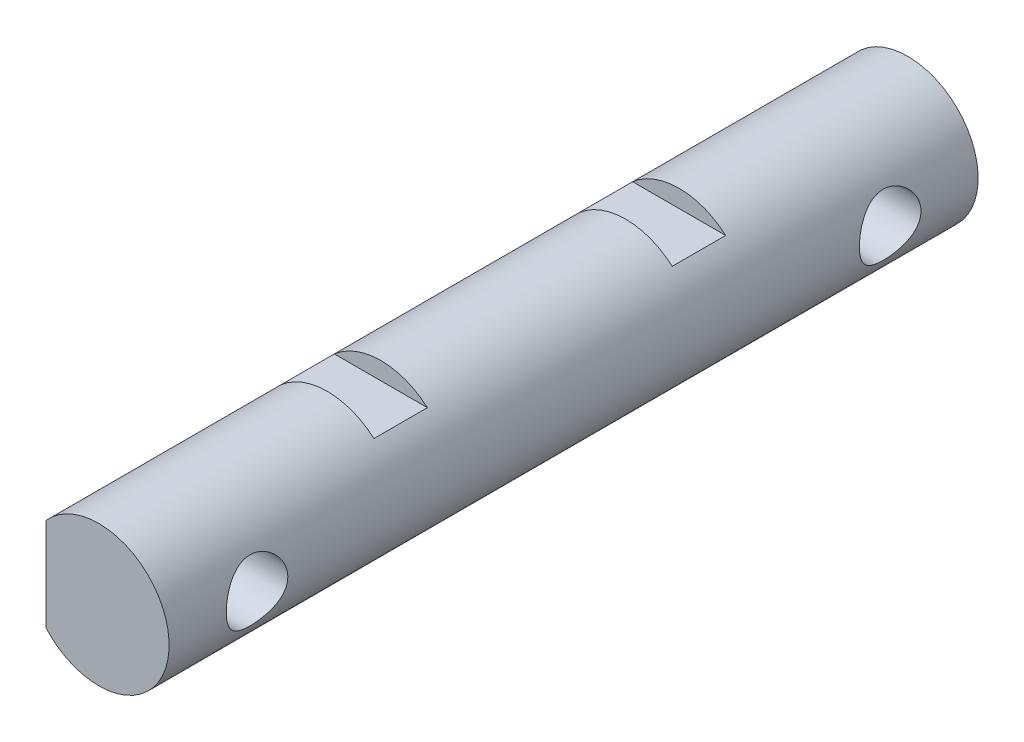
from build123d import *

# Parameters (mm, degrees)
SKETCH_1_R           = 20
EXTRUDE_1_DEPTH      = 115
CUT_EXTRUDE_START    = -65
SKETCH_2_OUTSIDE_W   = 89.37
SKETCH_2_OUTSIDE_H   = 89.37
SKETCH_2_OUTSIDE_W_2 = 80.530626202
SKETCH_2_OUTSIDE_H_2 = 30
CUT_EXTRUDE_1_DEPTH  = 15.2
CUT_EXTRUDE_2_DEPTH  = 50


with BuildPart() as part:
    # 草图1 → 凸台-拉伸1 (new, symmetric)
    with BuildSketch(Plane.XY):
        Circle(SKETCH_1_R)
    extrude(amount=EXTRUDE_1_DEPTH, both=True)

    # 草图2 outside → 切除-拉伸1 (cut)
    with BuildSketch(Plane.XY.offset(115).offset(CUT_EXTRUDE_START)):
        Rectangle(SKETCH_2_OUTSIDE_W, SKETCH_2_OUTSIDE_H)
        Rectangle(SKETCH_2_OUTSIDE_W_2, SKETCH_2_OUTSIDE_H_2, mode=Mode.SUBTRACT)
    cut_extrude_1 = extrude(amount=-CUT_EXTRUDE_1_DEPTH, mode=Mode.SUBTRACT)

    # 草图3 → 切除-拉伸2 (cut)
    with BuildSketch(Plane.XY.offset(115)):
        Polygon((-15, -119.751298217), (-15, -13.228756555), (-15, 13.228756555), (-15, 119.751298217), (-228.045083324, 119.751298217), (-228.045083324, -119.751298217), align=None)
    cut_extrude_2 = extrude(amount=-CUT_EXTRUDE_2_DEPTH, mode=Mode.SUBTRACT)

    # 草图4 → M20 螺纹孔1 (revolve, cut)
    with BuildSketch(Plane(origin=(-15, 0, 90), x_dir=(0, 0, 1), z_dir=(0, 1, 0))):
        Polygon((0, 0), (0, 52.757530416), (8.75, 47.5), (8.75, 0), align=None)
    hole_wizard_m20_1 = revolve(axis=Axis((-21.35, 0, 90), (1, 0, 0)), mode=Mode.SUBTRACT)

    # 镜向1: 切除-拉伸1, 切除-拉伸2, M20 螺纹孔1 across plane
    add(cut_extrude_1.mirror(Plane.XY), mode=Mode.SUBTRACT)
    add(cut_extrude_2.mirror(Plane.XY), mode=Mode.SUBTRACT)
    add(hole_wizard_m20_1.mirror(Plane.XY), mode=Mode.SUBTRACT)


solid = part.part
